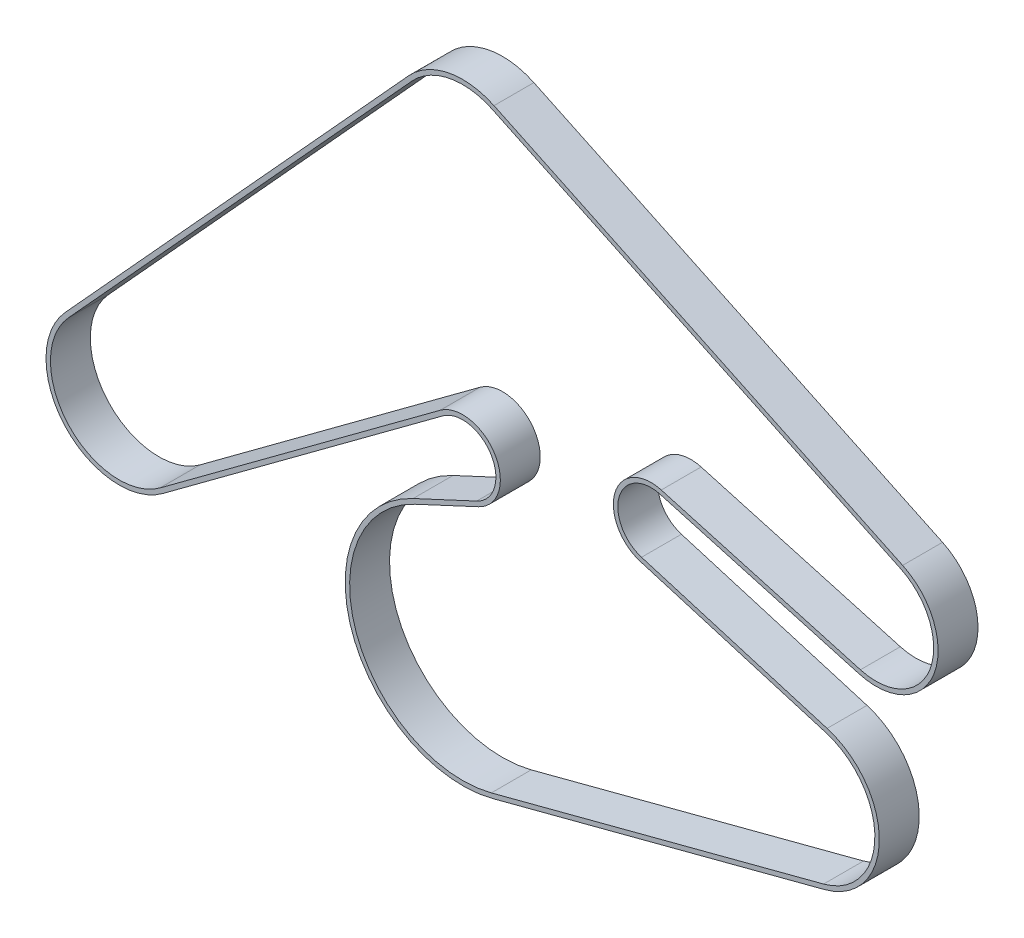
from build123d import *

# Parameters (mm, degrees)
EXTRUDE_THIN1_DEPTH = 18


with BuildPart() as part:
    # Sketch1 → Extrude-Thin1 (new body)
    with BuildSketch(Plane.XY):
        with BuildLine():
            Line((6.327716808, 61.4), (-22.357932721, 48.053333333))
            ThreePointArc((-22.357932721, 48.053333333), (-49.857891872, -17.97750311), (13.453428864, -51.264073695))
            Line((13.453428864, -51.264073695), (163.376663255, -11.919140225))
            ThreePointArc((163.376663255, -11.919140225), (187.995352271, 19.446169247), (164.443175515, 51.620032198))
            Line((164.443175515, 51.620032198), (80.707647493, 76.627258092))
            ThreePointArc((80.707647493, 76.627258092), (70.593974061, 95.179284225), (89.0659579, 105.438420494))
            Line((89.0659579, 105.438420494), (178.940955528, 80.129006849))
            ThreePointArc((178.940955528, 80.129006849), (212.749176963, 97.252513036), (198.527826902, 132.380329695))
            Line((198.527826902, 132.380329695), (14.139419596, 219.817391125))
            ThreePointArc((14.139419596, 219.817391125), (-6.373631689, 222.37864758), (-24.385542849, 212.233877304))
            Line((-24.385542849, 212.233877304), (-179.385542849, 42.233877304))
            ThreePointArc((-179.385542849, 42.233877304), (-179.495266598, -2.112935452), (-135.368386906, -6.525455083))
            Line((-135.368386906, -6.525455083), (-8.923460497, 87.057025038))
            ThreePointArc((-8.923460497, 87.057025038), (12.893998789, 82.664515329), (6.327716808, 61.4))
        make_face()
        with BuildLine():
            Line((7.171412382, 59.586666667), (-21.514237147, 46.24))
            ThreePointArc((-21.514237147, 46.24), (-47.97646199, -17.299106766), (12.945752303, -49.329580348))
            Line((12.945752303, -49.329580348), (162.868986694, -9.984646878))
            ThreePointArc((162.868986694, -9.984646878), (185.995633952, 19.479734747), (163.870861847, 49.70366661))
            Line((163.870861847, 49.70366661), (80.135333826, 74.710892504))
            ThreePointArc((80.135333826, 74.710892504), (68.673170602, 95.736522122), (89.60808562, 107.363543226))
            Line((89.60808562, 107.363543226), (179.483083248, 82.054129582))
            ThreePointArc((179.483083248, 82.054129582), (210.876431723, 97.954528184), (197.670892381, 130.573215081))
            Line((197.670892381, 130.573215081), (13.282485075, 218.010276511))
            ThreePointArc((13.282485075, 218.010276511), (-5.98735098, 220.416305302), (-22.907631161, 210.886369588))
            Line((-22.907631161, 210.886369588), (-177.907631161, 40.886369588))
            ThreePointArc((-177.907631161, 40.886369588), (-178.010704986, -0.772757545), (-136.558181639, -4.917851744))
            Line((-136.558181639, -4.917851744), (-10.11325523, 88.664628376))
            ThreePointArc((-10.11325523, 88.664628376), (14.613198627, 83.686450706), (7.171412382, 59.586666667))
        make_face(mode=Mode.SUBTRACT)
    extrude(amount=EXTRUDE_THIN1_DEPTH)


solid = part.part
